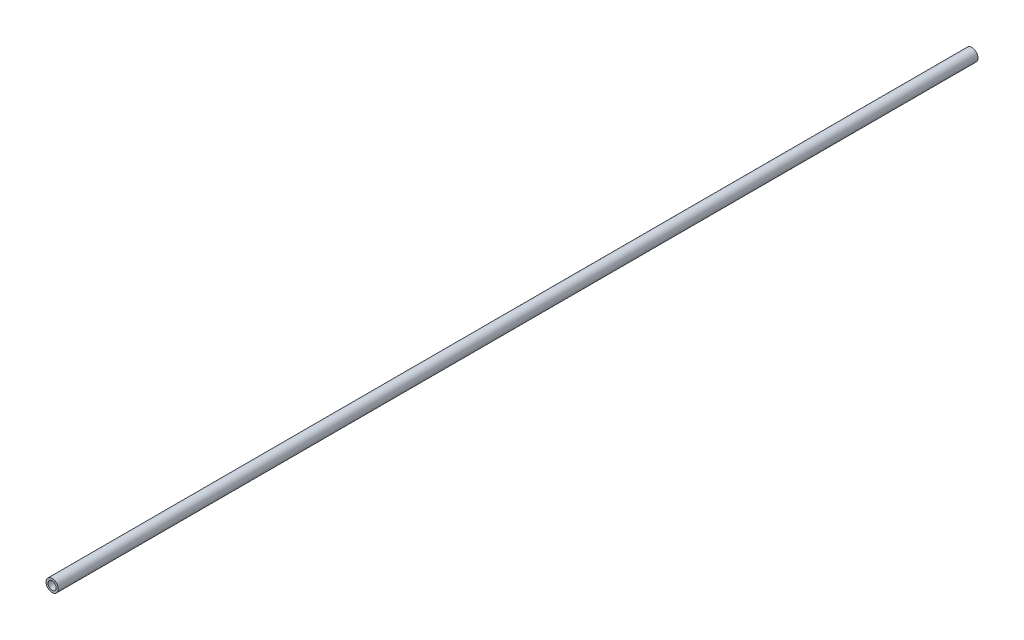
from build123d import *

# Parameters (mm, degrees)
ESBO_O1_R                = 3
ESBO_O1_R_2              = 2
RESSALTO_EXTRUS_O1_DEPTH = 450


with BuildPart() as part:
    # Esboço1 → Ressalto-extrusão1 (new body)
    with BuildSketch(Plane.XY):
        Circle(ESBO_O1_R)
        Circle(ESBO_O1_R_2, mode=Mode.SUBTRACT)
    extrude(amount=RESSALTO_EXTRUS_O1_DEPTH)


solid = part.part
